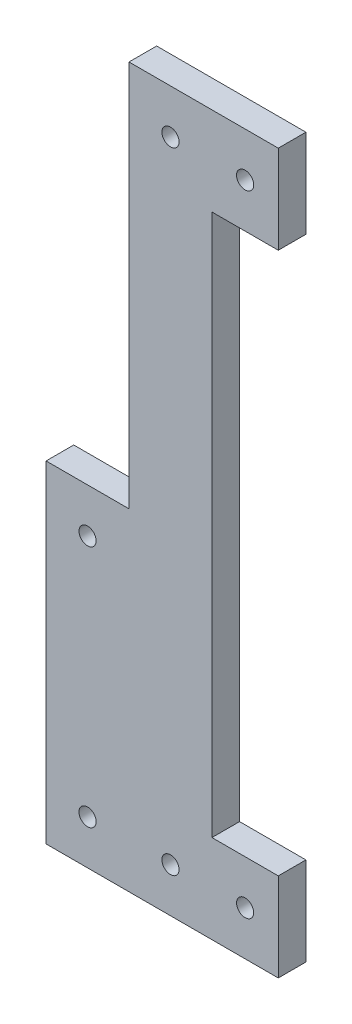
from build123d import *

# Parameters (mm, degrees)
SKETCH1_W           = 15
SKETCH1_H           = 60
SKETCH1_R           = 1.55
SKETCH1_W_2         = 12
SKETCH1_H_2         = 16
BOSS_EXTRUDE1_DEPTH = 5


with BuildPart() as part:
    # Sketch1 → Boss-Extrude1 (new body)
    # profile 1 of 4: a face of its own
    with BuildSketch(Plane.XY):
        with Locations((7.5, 30)):
            Rectangle(SKETCH1_W, SKETCH1_H)
        with Locations((7.5, 8)):
            Circle(SKETCH1_R, mode=Mode.SUBTRACT)
        with Locations((7.5, 52)):
            Circle(SKETCH1_R, mode=Mode.SUBTRACT)
    # profile 2 of 4: a face of its own
    with BuildSketch(Plane.XY):
        Polygon((15, 60), (15, 0), (30, 0), (30, 16), (30, 114), (30, 130), (15, 130), align=None)
        with Locations((22.5, 8)):
            Circle(SKETCH1_R, mode=Mode.SUBTRACT)
        with Locations((22.5, 122)):
            Circle(SKETCH1_R, mode=Mode.SUBTRACT)
    # profile 3 of 4: a face of its own
    with BuildSketch(Plane.XY):
        with Locations((36, 8)):
            Rectangle(SKETCH1_W_2, SKETCH1_H_2)
        with Locations((36, 8)):
            Circle(SKETCH1_R, mode=Mode.SUBTRACT)
    # profile 4 of 4: a face of its own
    with BuildSketch(Plane.XY):
        with Locations((36, 122)):
            Rectangle(SKETCH1_W_2, SKETCH1_H_2)
        with Locations((36, 122)):
            Circle(SKETCH1_R, mode=Mode.SUBTRACT)
    extrude(amount=BOSS_EXTRUDE1_DEPTH)


solid = part.part
